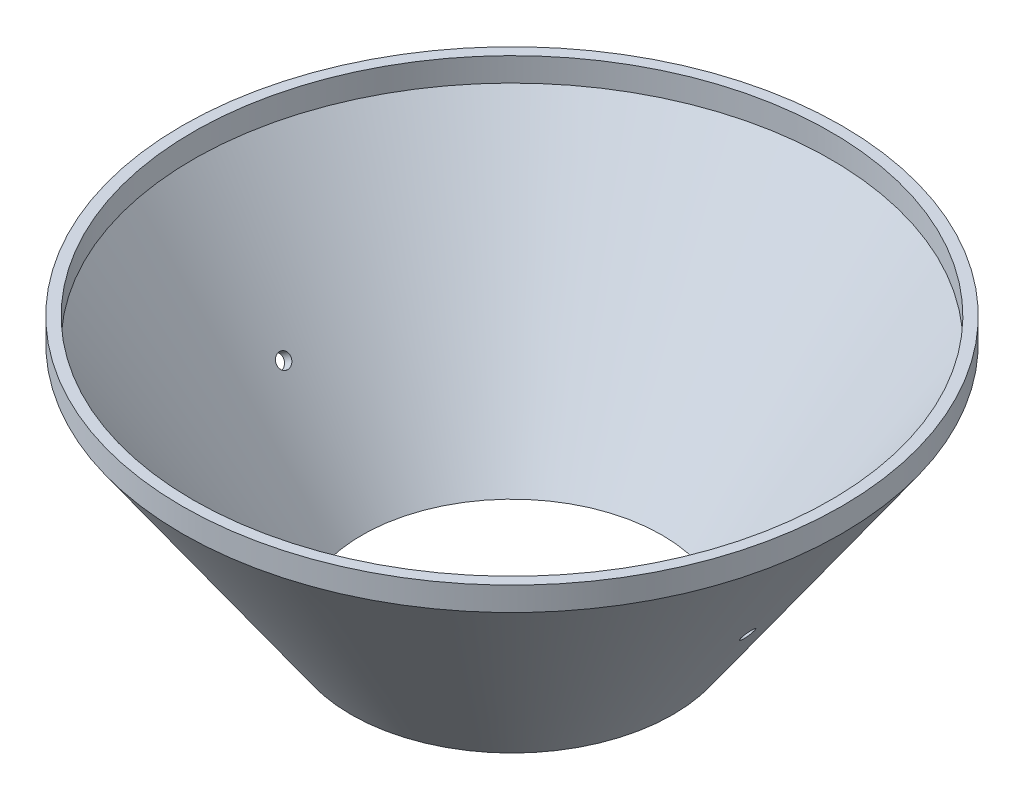
from build123d import *

# Parameters (mm, degrees)
SKETCH36_R          = 0.6
SIDE_HOLES_DEPTH    = 2
CIRPATTERN2_COUNT   = 2
SKETCH37_R          = 27.75
SKETCH37_R_2        = 26.834419058
BOSS_EXTRUDE1_DEPTH = 2


with BuildPart() as part:
    # Sketch35 → Revolve1 (revolve)
    with BuildSketch(Plane.XY):
        Polygon((12.63, 0), (13.545580942, 0), (27.75, 20.286012765), (26.834419058, 20.286012765), align=None)
    revolve(axis=Axis((0, 20.286012765, 0), (0, -1, 0)))

    # Sketch36 → side-holes (cut, symmetric)
    with BuildSketch(Plane(origin=(8.474857205, -5.9341589, 0), x_dir=(0, 0, 1), z_dir=(-0.8191520442889934, 0.5735764363510439, 0))):
        with Locations((0, 18.744270391)):
            Circle(SKETCH36_R)
    side_holes = extrude(amount=SIDE_HOLES_DEPTH, both=True, mode=Mode.SUBTRACT)

    # CirPattern2: side-holes ×2 about axis
    cirpattern2_axis = Axis((0, 0, 0), (0, 1, 0))
    for i in range(1, CIRPATTERN2_COUNT):
        add(side_holes.rotate(cirpattern2_axis, i * 360 / CIRPATTERN2_COUNT), mode=Mode.SUBTRACT)

    # Sketch37 → Boss-Extrude1 (add)
    with BuildSketch(Plane(origin=(0, 20.286012765, 0), x_dir=(1, 0, 0), z_dir=(0, 1, 0))):
        Circle(SKETCH37_R)
        Circle(SKETCH37_R_2, mode=Mode.SUBTRACT)
    extrude(amount=BOSS_EXTRUDE1_DEPTH)


solid = part.part
